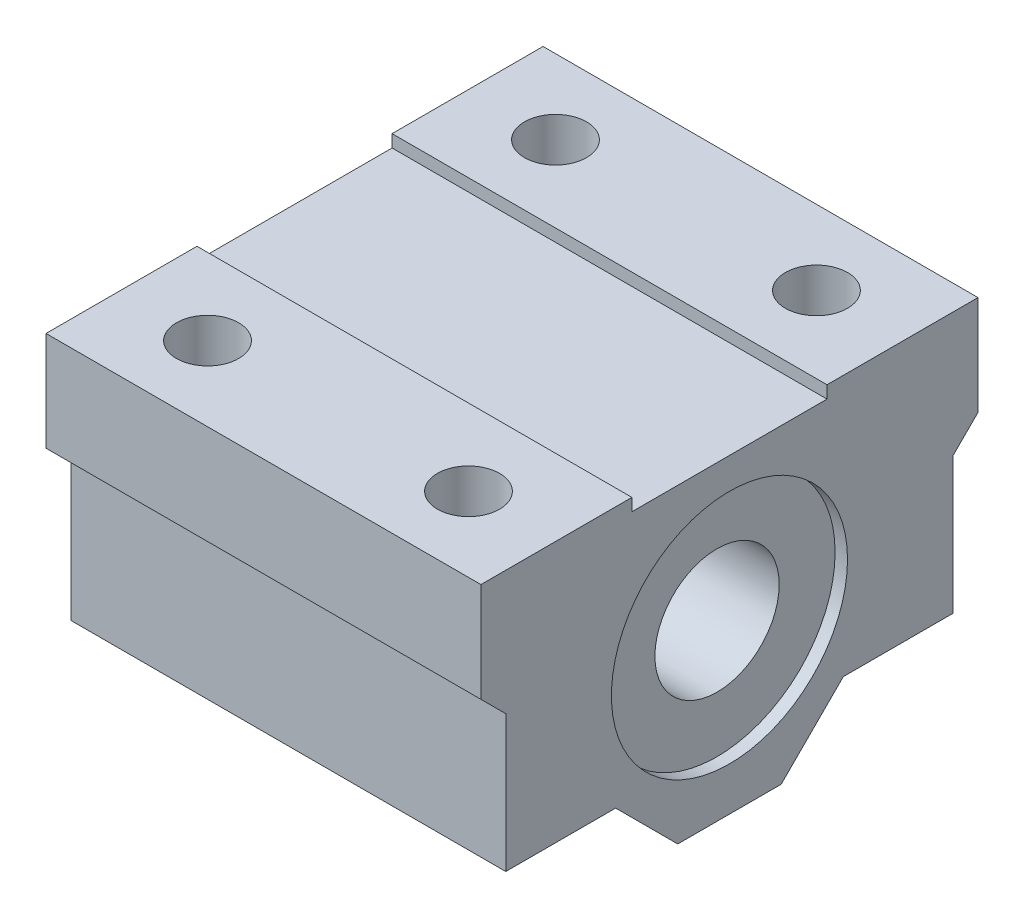
from build123d import *

# Parameters (mm, degrees)
SKETCH1_R           = 5
BOSS_EXTRUDE1_DEPTH = 17.5
SKETCH3_R           = 2.5
CUT_EXTRUDE1_DEPTH  = 16
SKETCH4_R           = 2.15
CUT_EXTRUDE2_DEPTH  = 26
SKETCH9_R           = 9.5
CUT_EXTRUDE5_DEPTH  = 1


with BuildPart() as part:
    # Sketch1 → Boss-Extrude1 (new, symmetric)
    with BuildSketch(Plane(origin=(0, 0, 0), x_dir=(0, 0, -1), z_dir=(1, 0, 0))):
        Polygon((-20, 26), (-7.85, 26), (-7.85, 25), (7.85, 25), (7.85, 26), (20, 26), (20, 18), (18, 16), (18, 5), (9.161099759, 5), (4.161099759, 0), (-4.161099759, 0), (-9.161099759, 5), (-18, 5), (-18, 16), (-20, 18), align=None)
        with Locations((0, 13)):
            Circle(SKETCH1_R, mode=Mode.SUBTRACT)
    extrude(amount=BOSS_EXTRUDE1_DEPTH, both=True)

    # Sketch3 → Cut-Extrude1 (cut)
    with BuildSketch(Plane(origin=(0, 18, 0), x_dir=(-1, 0, 0), z_dir=(0, 1, 0))):
        with Locations(Location((-10.5, 14, 0), (0, 0, 90))):
            Circle(SKETCH3_R)
        with Locations(Location((10.5, 14, 0), (0, 0, 90))):
            Circle(SKETCH3_R)
        with Locations(Location((-10.5, -14, 0), (0, 0, 90))):
            Circle(SKETCH3_R)
        with Locations(Location((10.5, -14, 0), (0, 0, 90))):
            Circle(SKETCH3_R)
    extrude(amount=CUT_EXTRUDE1_DEPTH, mode=Mode.SUBTRACT)

    # Sketch4 → Cut-Extrude2 (cut)
    with BuildSketch(Plane(origin=(0, 18, 0), x_dir=(-1, 0, 0), z_dir=(0, 1, 0))):
        with Locations(Location((-10.5, 14, 0), (0, 0, 90))):
            Circle(SKETCH4_R)
        with Locations(Location((10.5, 14, 0), (0, 0, 90))):
            Circle(SKETCH4_R)
        with Locations(Location((10.5, -14, 0), (0, 0, 90))):
            Circle(SKETCH4_R)
        with Locations(Location((-10.5, -14, 0), (0, 0, 90))):
            Circle(SKETCH4_R)
    extrude(amount=-CUT_EXTRUDE2_DEPTH, mode=Mode.SUBTRACT)

    # Sketch9 → Cut-Extrude5 (cut)
    with BuildSketch(Plane(origin=(17.5, 0, 0), x_dir=(0, 0, -1), z_dir=(1, 0, 0))):
        with Locations((0, 13)):
            Circle(SKETCH9_R)
    cut_extrude5 = extrude(amount=-CUT_EXTRUDE5_DEPTH, mode=Mode.SUBTRACT)

    # Mirror4: Cut-Extrude5 across plane
    add(cut_extrude5.mirror(Plane(origin=(0, 0, 0), x_dir=(0, 0, 1), z_dir=(1, 0, 0))), mode=Mode.SUBTRACT)


solid = part.part
